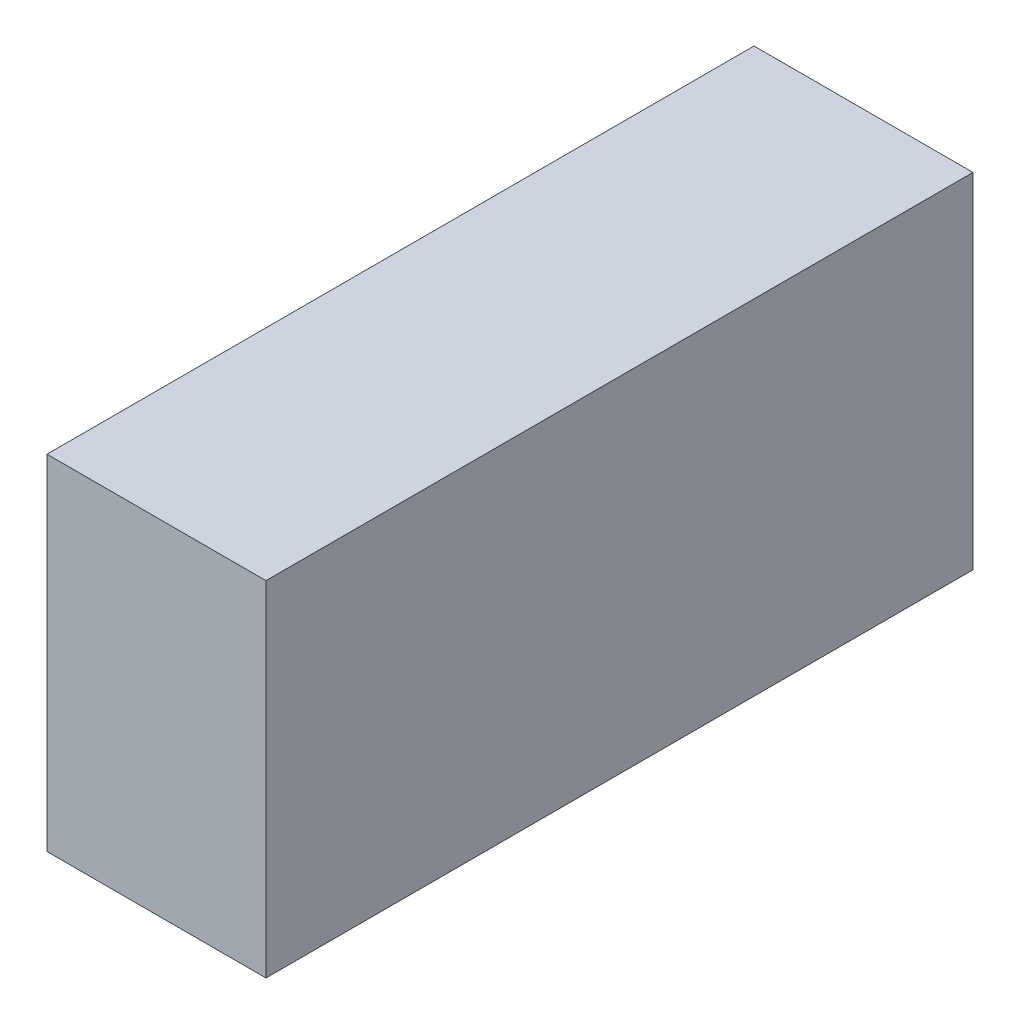
from build123d import *

# Parameters (mm, degrees)
SKETCH1_W           = 35
SKETCH1_H           = 55
BOSS_EXTRUDE1_DEPTH = 56.5


with BuildPart() as part:
    # Sketch1 → Boss-Extrude1 (new, symmetric)
    with BuildSketch(Plane.XY):
        Rectangle(SKETCH1_W, SKETCH1_H)
    extrude(amount=BOSS_EXTRUDE1_DEPTH, both=True)


solid = part.part
